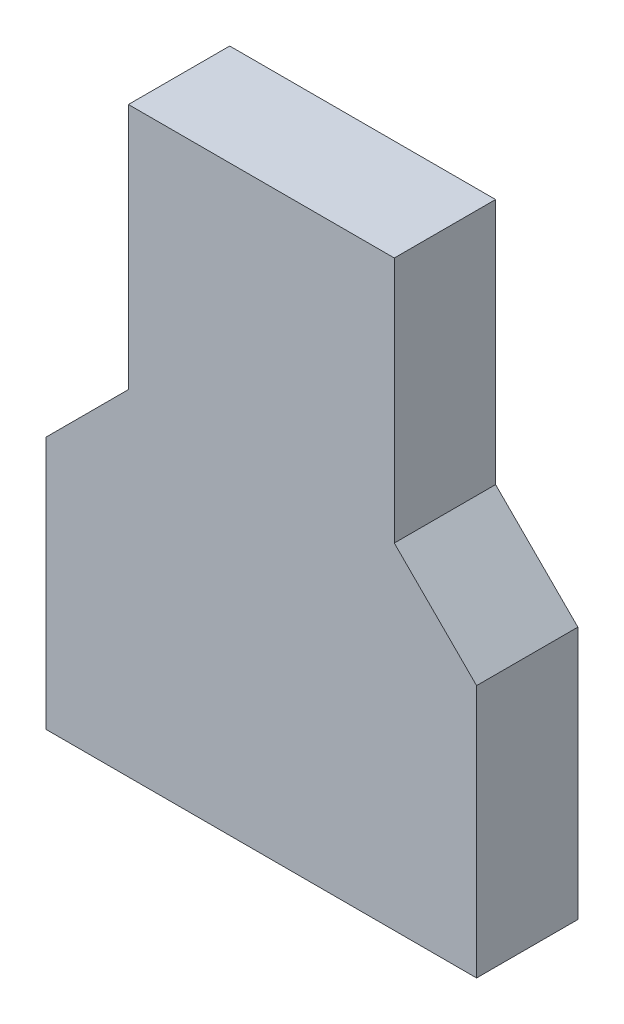
from build123d import *

# Parameters (mm, degrees)
BOSS_EXTRUDE1_DEPTH = 1


with BuildPart() as part:
    # Sketch1 → Boss-Extrude1 (new, symmetric)
    with BuildSketch(Plane.XY):
        Polygon((2.625, -5.75), (4.25, -5.75), (4.25, -0.75), (2.625, 0.875), (2.625, 5.75), (-2.625, 5.75), (-2.625, 0.875), (-4.25, -0.75), (-4.25, -5.75), (-2.625, -5.75), align=None)
    extrude(amount=BOSS_EXTRUDE1_DEPTH, both=True)


solid = part.part
